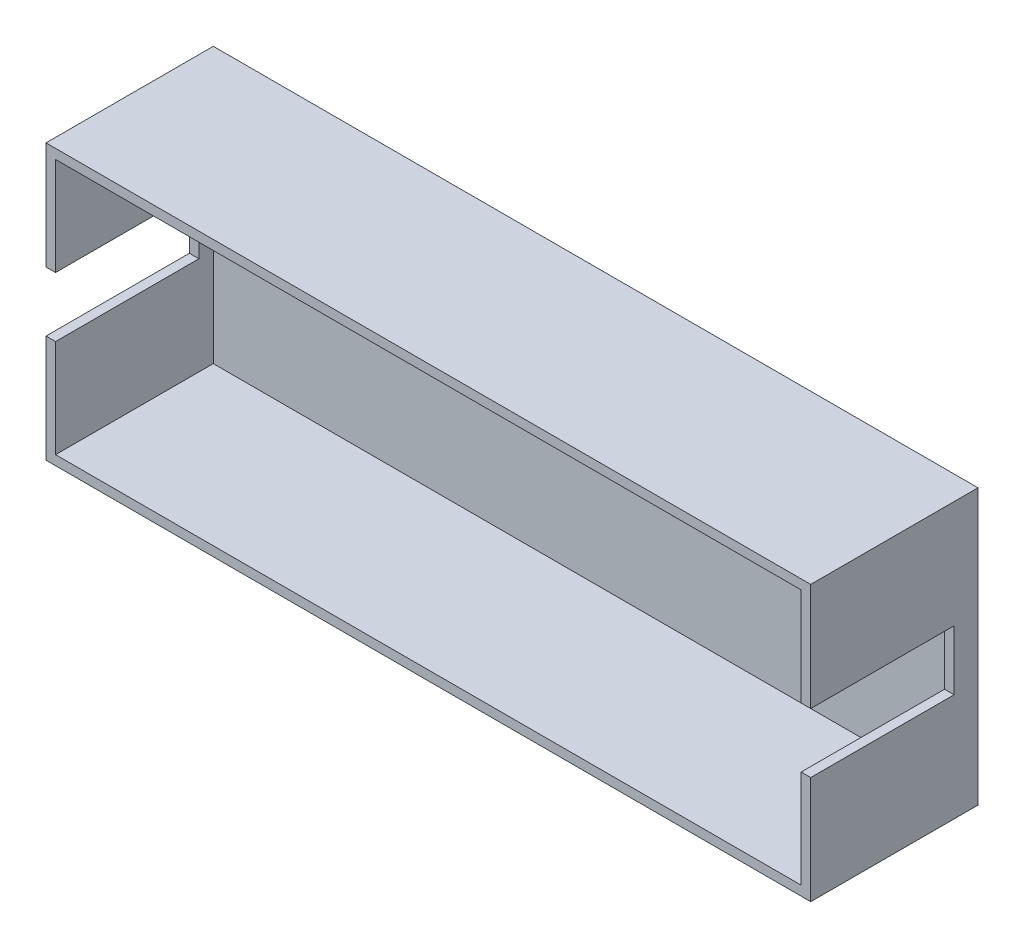
from build123d import *

# Parameters (mm, degrees)
SKETCH2_W           = 64
SKETCH2_H           = 23
BOSS_EXTRUDE1_DEPTH = 14
SKETCH3_W           = 62.4
SKETCH3_H           = 21.4
CUT_EXTRUDE1_DEPTH  = 13.2
SKETCH4_W           = 24
SKETCH4_H           = 5
CUT_EXTRUDE3_DEPTH  = 67.515035894


with BuildPart() as part:
    # Sketch2 → Boss-Extrude1 (new body)
    with BuildSketch(Plane.XY):
        Rectangle(SKETCH2_W, SKETCH2_H)
    extrude(amount=BOSS_EXTRUDE1_DEPTH)

    # Sketch3 → Cut-Extrude1 (cut)
    with BuildSketch(Plane.XY.offset(14)):
        Rectangle(SKETCH3_W, SKETCH3_H)
    extrude(amount=-CUT_EXTRUDE1_DEPTH, mode=Mode.SUBTRACT)

    # Sketch4 → Cut-Extrude3 (cut, through all)
    with BuildSketch(Plane(origin=(32, 0, 0), x_dir=(0, 0, -1), z_dir=(1, 0, 0))):
        with Locations((-14, 0)):
            Rectangle(SKETCH4_W, SKETCH4_H)
    extrude(amount=-CUT_EXTRUDE3_DEPTH, mode=Mode.SUBTRACT)


solid = part.part
